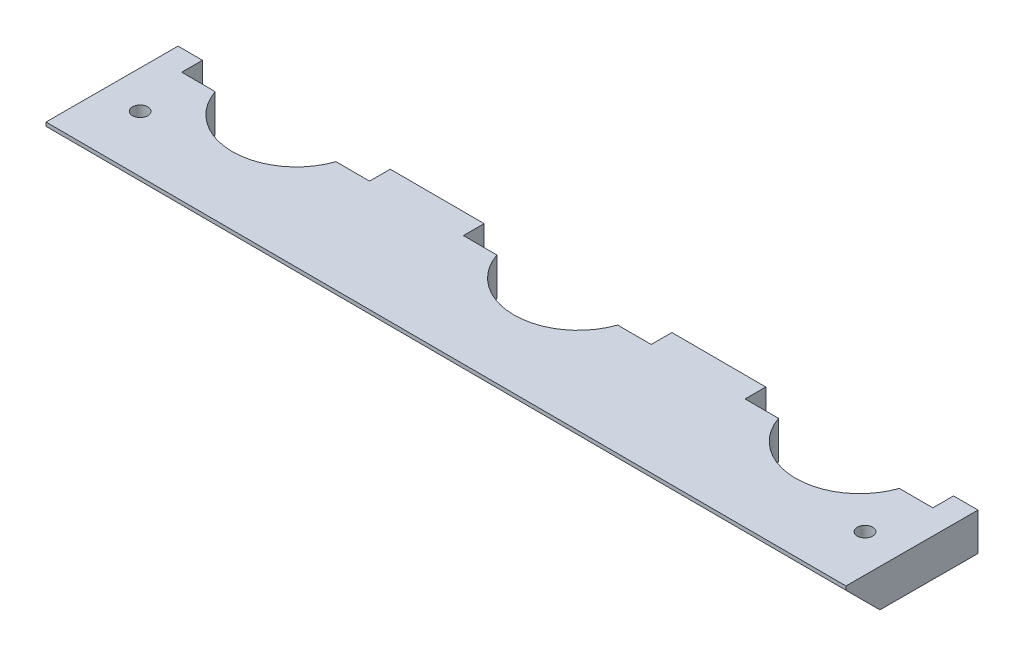
from build123d import *

# Parameters (mm, degrees)
BOSS_EXTRUDE3_DEPTH        = 10
SKETCH4_R                  = 1.5
BOSS_EXTRUDE4_DEPTH        = 5
RIB6_REACH                 = 158.985
SKETCH5_WALL_W             = 329.861950248
SKETCH5_WALL_H             = 2.5
CHAMFER2_SIZE              = 1
LPATTERN4_COUNT            = 2
LPATTERN4_PITCH            = 75
LPATTERN4_COPY_1_REACH     = 158.985
LPATTERN4_COPY_1_SKETCH_W  = 329.861950248
LPATTERN4_COPY_1_SKETCH_H  = 2.5
CHAMFER2_OF_LPATTERN4_SIZE = 1
CHAMFER3_SIZE              = 9
SKETCH8_R                  = 2.05
CUT_EXTRUDE1_DEPTH         = 4
SKETCH9_R                  = 1.6
CUT_EXTRUDE2_DEPTH         = 5


with BuildPart() as part:
    # Sketch2 → Boss-Extrude3 (new body)
    with BuildSketch(Plane(origin=(0, 0, 0), x_dir=(1, 0, 0), z_dir=(0, 1, 0))):
        with BuildLine():
            Line((-138.973021921, 39.179223473), (-139.052157616, 4.179312937))
            Line((-139.052157616, 4.179312937), (73.947297933, 3.697715709))
            Line((73.947297933, 3.697715709), (74.026978079, 38.697625014))
            Line((74.026978079, 38.697625014), (67.526578048, 38.712322585))
            Line((67.526578048, 38.712322585), (67.51414235, 33.212297518))
            Line((67.51414235, 33.212297518), (58.599731895, 33.232453229))
            ThreePointArc((58.599731895, 33.232453229), (42.488076808, 21.768891824), (26.428425, 33.305193378))
            Line((26.428425, 33.305193378), (17.51414235, 33.3253488))
            Line((17.51414235, 33.3253488), (17.526578048, 38.825373866))
            Line((17.526578048, 38.825373866), (-7.473230244, 38.881899074))
            Line((-7.473230244, 38.881899074), (-7.485665941, 33.381874007))
            Line((-7.485665941, 33.381874007), (-16.400076396, 33.402029717))
            ThreePointArc((-16.400076396, 33.402029717), (-32.511731484, 21.938468313), (-48.571383292, 33.474769867))
            Line((-48.571383292, 33.474769867), (-57.485665941, 33.494925288))
            Line((-57.485665941, 33.494925288), (-57.473230244, 38.994950355))
            Line((-57.473230244, 38.994950355), (-82.473038536, 39.051475562))
            Line((-82.473038536, 39.051475562), (-82.485474233, 33.551450496))
            Line((-82.485474233, 33.551450496), (-91.399884688, 33.571606206))
            ThreePointArc((-91.399884688, 33.571606206), (-107.511539776, 22.108044802), (-123.571191584, 33.644346356))
            Line((-123.571191584, 33.644346356), (-132.485474233, 33.664501777))
            Line((-132.485474233, 33.664501777), (-132.473038536, 39.164526844))
            Line((-132.473038536, 39.164526844), (-138.973021921, 39.179223473))
        make_face()
    extrude(amount=BOSS_EXTRUDE3_DEPTH)

    # Sketch4 → Boss-Extrude4 (add)
    with BuildSketch(Plane(origin=(0.087874316, 0, -38.864803222), x_dir=(-0.99999744389135, 0, -0.002261019850970016), z_dir=(0.002261019850970016, 0, -0.99999744389135))):
        Polygon((62.56118779, -12), (57.561251693, 0), (82.561123887, 0), (77.56118779, -12), align=None)
        with Locations((70.06118779, -8.5)):
            Circle(SKETCH4_R, mode=Mode.SUBTRACT)
    boss_extrude4 = extrude(amount=-BOSS_EXTRUDE4_DEPTH)

    # Sketch5 wall → Rib6 (add, up to next)
    with BuildSketch(Plane(origin=(-77.492333887, -6, -30.540192335), x_dir=(-0.001139262394, 0.863778900906, 0.503869737562), z_dir=(-0.001953021242, -0.503871025511, 0.863776692993)), mode=Mode.PRIVATE) as rib6_sk1:
        with Locations((0, -1.25)):
            Rectangle(SKETCH5_WALL_W, SKETCH5_WALL_H)
    rib6_tool1 = extrude(rib6_sk1.sketch, amount=-RIB6_REACH, mode=Mode.PRIVATE) - part.part
    rib6 = rib6_tool1.solids().sort_by_distance((-77.492333887, -6, -30.540192335))[0]
    add(rib6)

    # Mirror2: Rib6 across plane
    add(rib6.mirror(Plane(origin=(-70.061008706, 0, -0.158409736), x_dir=(-0.0022610198509701073, 0, 0.99999744389135), z_dir=(0.99999744389135, 0, 0.002261019850970107))))

    # Chamfer2
    chamfer2_edges = [part.edges().sort_by_distance(p)[0] for p in [
        (-68.484443323, -8.5, -34.01983421),
    ]]
    chamfer(chamfer2_edges, length=CHAMFER2_SIZE)

    # LPattern4: Boss-Extrude4, Rib6 ×2
    with Locations(*[Vector(0.9999974438913499, 0, 0.002261019850970079) * (i * LPATTERN4_PITCH) for i in range(1, LPATTERN4_COUNT)]):
        add(boss_extrude4)
        add(rib6)

    # LPattern4 copy 1 sketch → LPattern4 copy 1 (add, up to next)
    with BuildSketch(Plane(origin=(12.507436062, -6, -30.336700548), x_dir=(-0.0011392623880184954, 0.863778900906, 0.5038697375620136), z_dir=(-0.0019530212415939509, -0.503871025511, 0.863776692993001)), mode=Mode.PRIVATE) as lpattern4_copy_1_sk1:
        with Locations((0, 1.25)):
            Rectangle(LPATTERN4_COPY_1_SKETCH_W, LPATTERN4_COPY_1_SKETCH_H)
    lpattern4_copy_1_tool1 = extrude(lpattern4_copy_1_sk1.sketch, amount=-LPATTERN4_COPY_1_REACH, mode=Mode.PRIVATE) - part.part
    add(lpattern4_copy_1_tool1.solids().sort_by_distance((12.507436062, -6, -30.336700548))[0])

    # Chamfer2 of LPattern4
    chamfer2_of_lpattern4_edges = [part.edges().sort_by_distance(p)[0] for p in [
        (6.515364969, -8.5, -33.850257721),
    ]]
    chamfer(chamfer2_of_lpattern4_edges, length=CHAMFER2_OF_LPATTERN4_SIZE)

    # Chamfer3
    chamfer3_edges = [part.edges().sort_by_distance(p)[0] for p in [
        (-32.552429841, 0, -3.938514323),
    ]]
    chamfer(chamfer3_edges, length=CHAMFER3_SIZE)

    # Sketch8 → Cut-Extrude1 (cut)
    with BuildSketch(Plane(origin=(0, 10, 0), x_dir=(1, 0, 0), z_dir=(0, 1, 0))):
        with Locations(Location((-129.018242433, 19.156613217, 0), (0, 0, 270))):
            Circle(SKETCH8_R)
    cut_extrude1 = extrude(amount=-CUT_EXTRUDE1_DEPTH, mode=Mode.SUBTRACT)

    # Sketch9 → Cut-Extrude2 (cut)
    with BuildSketch(Plane(origin=(0, 6, 0), x_dir=(1, 0, 0), z_dir=(0, 1, 0))):
        with Locations(Location((-129.018242433, 19.156613217, 0), (0, 0, 270))):
            Circle(SKETCH9_R)
    cut_extrude2 = extrude(amount=-CUT_EXTRUDE2_DEPTH, mode=Mode.SUBTRACT)

    # Mirror4: Cut-Extrude1, Cut-Extrude2 across plane
    add(cut_extrude1.mirror(Plane(origin=(-32.561168463, 0, -0.073621636), x_dir=(-0.002261019850969509, 0, 0.99999744389135), z_dir=(-0.99999744389135, 0, -0.0022610198509695084))), mode=Mode.SUBTRACT)
    add(cut_extrude2.mirror(Plane(origin=(-32.561168463, 0, -0.073621636), x_dir=(-0.002261019850969509, 0, 0.99999744389135), z_dir=(-0.99999744389135, 0, -0.0022610198509695084))), mode=Mode.SUBTRACT)


solid = part.part
